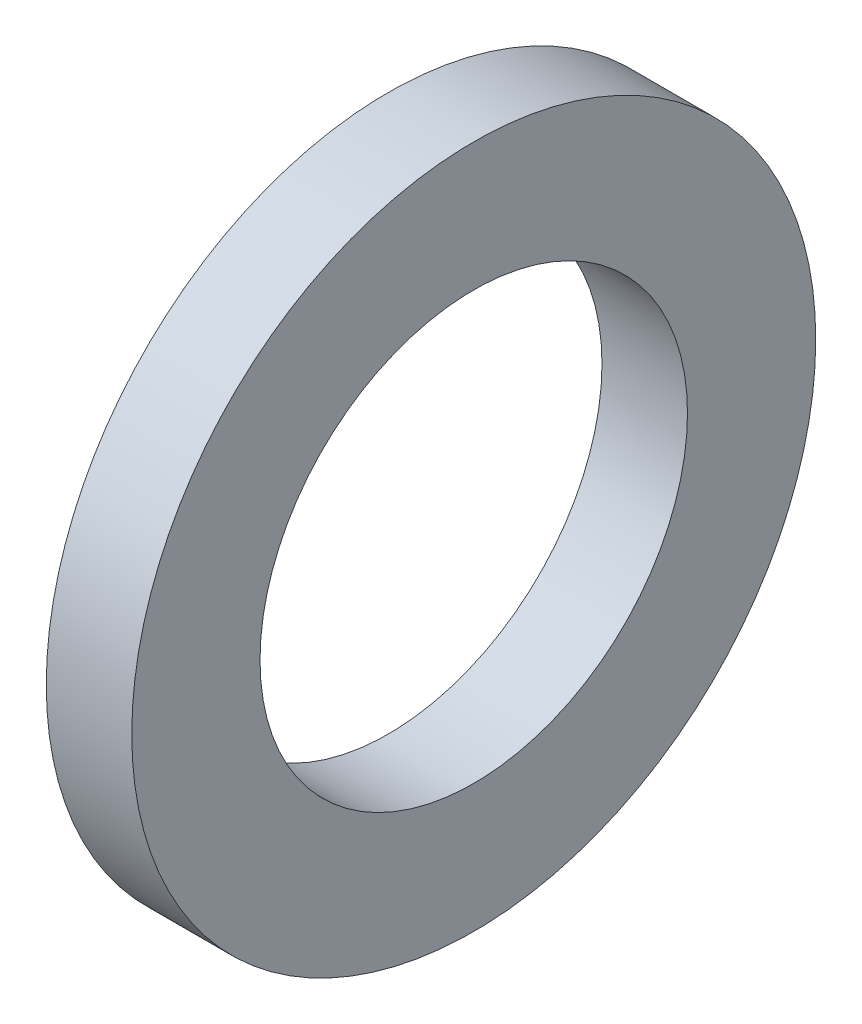
from build123d import *

# Parameters (mm, degrees)
SKETCH2_R               = 6
BOSS_EXTRUDE1_DEPTH     = 0.75
CUT_EXTRUDE1_DEPTH      = 9.61684397
CUT_EXTRUDE1_DEPTH_BACK = 9.61684397
SKETCH3_R               = 3.75


with BuildPart() as part:
    # Sketch2 → Boss-Extrude1 (new, symmetric)
    with BuildSketch(Plane(origin=(0, 0, 0), x_dir=(0, 0, -1), z_dir=(1, 0, 0))):
        Circle(SKETCH2_R)
    extrude(amount=BOSS_EXTRUDE1_DEPTH, both=True)

    # Sketch3 → Cut-Extrude1 (cut, two sides: drawn at the far end of the back side and taken through both)
    with BuildSketch(Plane(origin=(0.75, 0, 0), x_dir=(0, 0, -1), z_dir=(1, 0, 0)).offset(-CUT_EXTRUDE1_DEPTH_BACK)):
        Circle(SKETCH3_R)
    extrude(amount=CUT_EXTRUDE1_DEPTH + CUT_EXTRUDE1_DEPTH_BACK, mode=Mode.SUBTRACT)


solid = part.part
